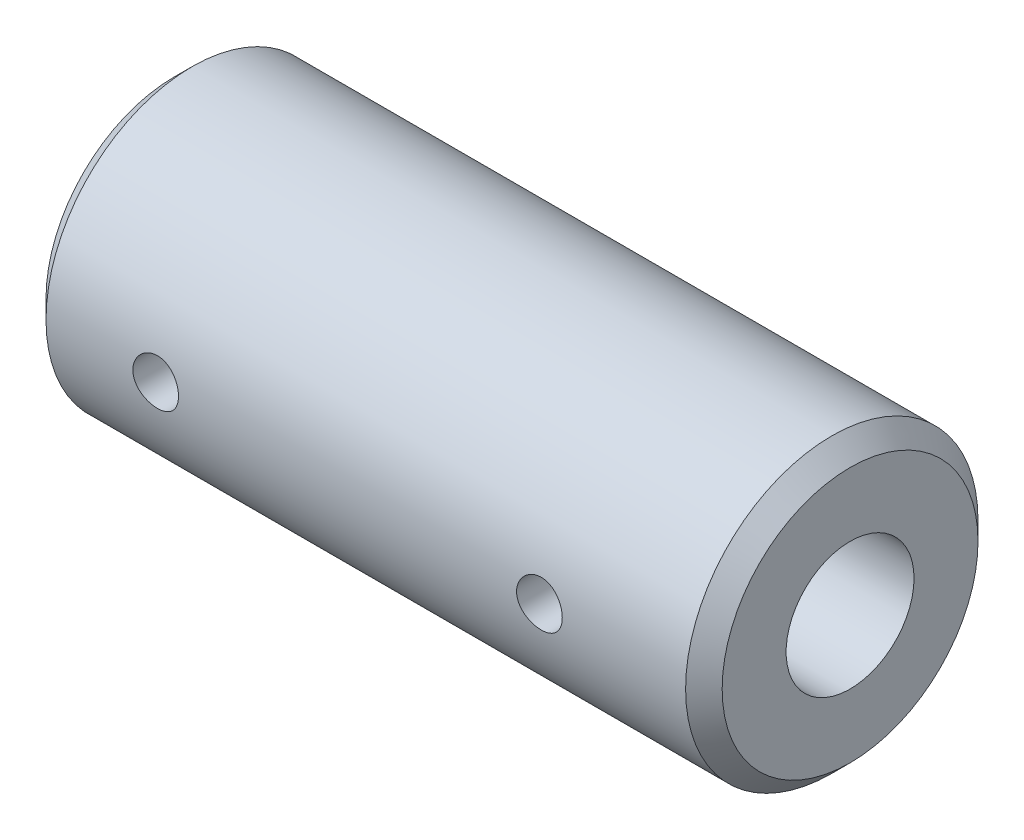
from build123d import *

# Parameters (mm, degrees)
SKETCH1_W                          = 37
SKETCH1_H                          = 8
CHANFROS_1X45_SIZE                 = 1
FURO_M8X1_0_EIXO_TRANSMISS_O_D     = 7
FURO_M8X1_0_EIXO_TRANSMISS_O_DEPTH = 14.896987833
FURO_M8X1_0_EIXO_TRANSMISS_O_TIP   = 2.103012167
FURO_5_EIXO_MOTOR_D                = 5
FURO_5_EIXO_MOTOR_DEPTH            = 14.497848452
FURO_5_EIXO_MOTOR_TIP              = 1.502151548
FUROS_DE_FIXA_O_M3X0_5_REACH       = 27.734
FUROS_DE_FIXA_O_M3X0_5_BORE_R      = 1.25


with BuildPart() as part:
    # Sketch1 → Bloco (revolve)
    with BuildSketch(Plane.XY, mode=Mode.PRIVATE) as bloco_sk:
        with Locations((0, 4)):
            Rectangle(SKETCH1_W, SKETCH1_H)
    revolve(bloco_sk.sketch.rotate(Axis((-18.5, 0, 0), (1, 0, 0)), 180), axis=Axis((-18.5, 0, 0), (1, 0, 0)))

    # Chanfros 1x45°
    chanfros_1x45_edges = [part.edges().sort_by_distance(p)[0] for p in [
        (18.5, 8, 0),
        (-18.5, 8, 0),
    ]]
    chamfer(chanfros_1x45_edges, length=CHANFROS_1X45_SIZE)

    # Furo M8x1.0 - Eixo Transmissão
    with Locations(Plane(origin=(18.5, 0, 0), x_dir=(0, 0, -1), z_dir=(1, 0, 0))):
        with Locations((0, 0)):
            Hole(FURO_M8X1_0_EIXO_TRANSMISS_O_D / 2, depth=FURO_M8X1_0_EIXO_TRANSMISS_O_DEPTH)
            with Locations((0, 0, -(FURO_M8X1_0_EIXO_TRANSMISS_O_DEPTH + FURO_M8X1_0_EIXO_TRANSMISS_O_TIP / 2))):  # 118° drill point
                Cone(0, FURO_M8X1_0_EIXO_TRANSMISS_O_D / 2, FURO_M8X1_0_EIXO_TRANSMISS_O_TIP, mode=Mode.SUBTRACT)

    # Furo Ø5 - Eixo Motor
    with Locations(Plane.ZY.offset(18.5)):
        with Locations((0, 0)):
            Hole(FURO_5_EIXO_MOTOR_D / 2, depth=FURO_5_EIXO_MOTOR_DEPTH)
            with Locations((0, 0, -(FURO_5_EIXO_MOTOR_DEPTH + FURO_5_EIXO_MOTOR_TIP / 2))):  # 118° drill point
                Cone(0, FURO_5_EIXO_MOTOR_D / 2, FURO_5_EIXO_MOTOR_TIP, mode=Mode.SUBTRACT)

    # Furos de Fixação M3x0.5 bore → Furos de Fixação M3x0.5 (cut, up to next)
    with BuildSketch(Plane.XY.offset(8), mode=Mode.PRIVATE) as furos_de_fixa_o_m3x0_5_sk1:
        with Locations((9.5, 0)):
            Circle(FUROS_DE_FIXA_O_M3X0_5_BORE_R)
    furos_de_fixa_o_m3x0_5_tool1 = extrude(furos_de_fixa_o_m3x0_5_sk1.sketch, amount=-FUROS_DE_FIXA_O_M3X0_5_REACH, mode=Mode.PRIVATE) & part.part
    # Furos de Fixação M3x0.5 bore → Furos de Fixação M3x0.5 (cut, up to next)
    with BuildSketch(Plane.XY.offset(8), mode=Mode.PRIVATE) as furos_de_fixa_o_m3x0_5_sk2:
        with Locations((-11.5, 0)):
            Circle(FUROS_DE_FIXA_O_M3X0_5_BORE_R)
    furos_de_fixa_o_m3x0_5_tool2 = extrude(furos_de_fixa_o_m3x0_5_sk2.sketch, amount=-FUROS_DE_FIXA_O_M3X0_5_REACH, mode=Mode.PRIVATE) & part.part
    add(furos_de_fixa_o_m3x0_5_tool1.solids().sort_by_distance((9.5, 0, 8))[0], mode=Mode.SUBTRACT)
    add(furos_de_fixa_o_m3x0_5_tool2.solids().sort_by_distance((-11.5, 0, 8))[0], mode=Mode.SUBTRACT)


solid = part.part
